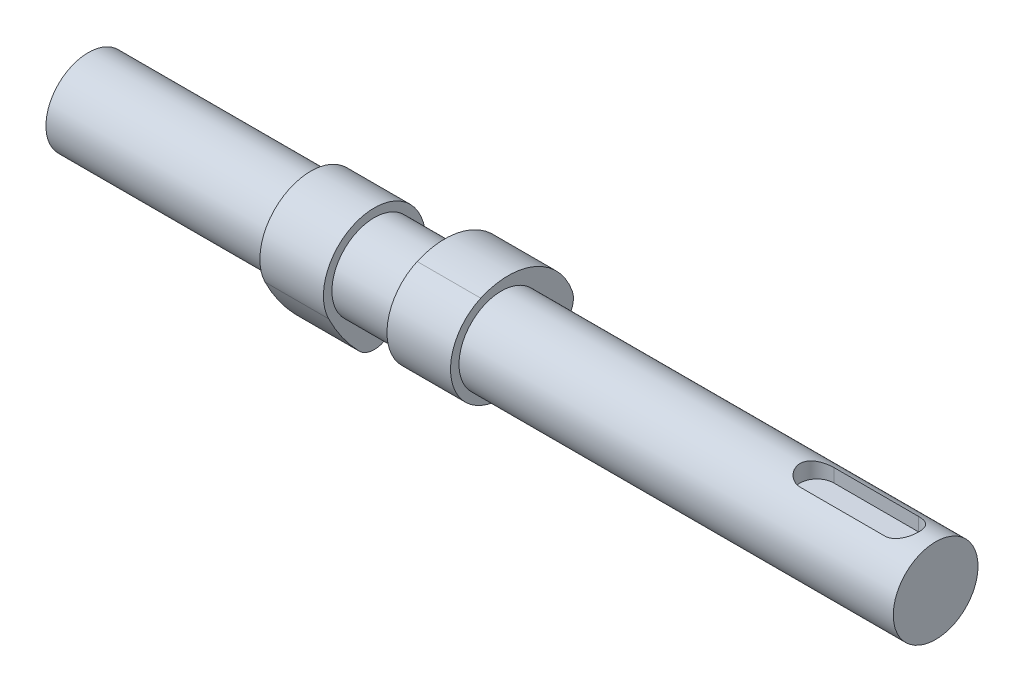
from build123d import *

# Parameters (mm, degrees)
BOSS_EXTRUDE1_DEPTH      = 125
BOSS_EXTRUDE1_DEPTH_BACK = 75
SKETCH1_R                = 10
BOSS_EXTRUDE4_START      = 15
BOSS_EXTRUDE4_DEPTH      = 7.5
BODY_MOVE_COPY2_ANGLE    = 90
CUT_EXTRUDE1_DEPTH       = 4


with BuildPart() as part:
    # Sketch1 → Boss-Extrude1 (new, two sides: drawn at the far end of the back side and taken through both)
    with BuildSketch(Plane(origin=(0, 0, 0), x_dir=(0, 0, -1), z_dir=(1, 0, 0)).offset(-BOSS_EXTRUDE1_DEPTH_BACK)):
        Circle(SKETCH1_R)
    extrude(amount=BOSS_EXTRUDE1_DEPTH + BOSS_EXTRUDE1_DEPTH_BACK)

    # Sketch3 → Cut-Extrude1 (cut)
    with BuildSketch(Plane(origin=(0, 10, 0), x_dir=(1, 0, 0), z_dir=(0, 1, 0))):
        with BuildLine():
            Line((97, 4), (117, 4))
            ThreePointArc((117, 4), (121, 0), (117, -4))
            Line((117, -4), (97, -4))
            ThreePointArc((97, -4), (93, 0), (97, 4))
        make_face()
    extrude(amount=-CUT_EXTRUDE1_DEPTH, mode=Mode.SUBTRACT)


with BuildPart() as body_2:
    # Sketch2 → Boss-Extrude4 (new, symmetric)
    with BuildSketch(Plane(origin=(0, 0, 0), x_dir=(0, 0, -1), z_dir=(1, 0, 0)).offset(BOSS_EXTRUDE4_START)):
        with BuildLine():
            ThreePointArc((-4.867089568, 10.968657125), (-10.868088345, -5.087696504), (5.306226617, -10.763083159))
            ThreePointArc((5.306226617, -10.763083159), (10.673744978, -7.573594418), (15.479542802, -3.587694386))
            ThreePointArc((15.479542802, -3.587694386), (16.864464688, -1.143374761), (16.712672037, 1.661917746))
            ThreePointArc((16.712672037, 1.661917746), (7.958571112, 11.035699457), (-4.867089568, 10.968657125))
        make_face()
    extrude(amount=BOSS_EXTRUDE4_DEPTH, both=True)


with BuildPart() as body_3:
    # Mirror9: mirrored copy
    add(body_2.part.mirror(Plane(origin=(0, 0, 0), x_dir=(0, 0, 1), z_dir=(1, 0, 0))))


with BuildPart() as body_3_1:
    # Body-Move/Copy2: moved
    add(body_3.part.rotate(Axis((0, 0, 0), (-1, 0, 0)), BODY_MOVE_COPY2_ANGLE))


solid = Compound([part.part, body_2.part, body_3_1.part])
